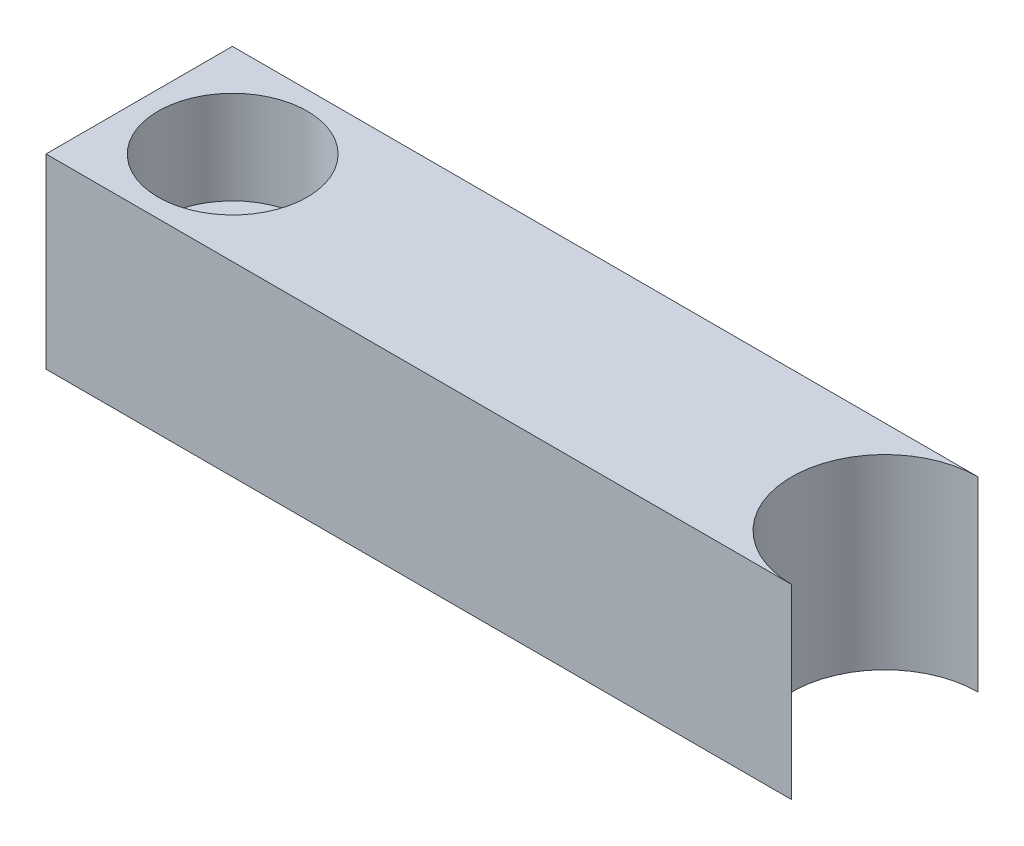
from build123d import *

# Parameters (mm, degrees)
BOSS_EXTRUDE2_DEPTH = 3.175
SKETCH1_6_W         = 3.175
SKETCH1_6_H         = 3.175
SKETCH1_6_R         = 1.27
BOSS_EXTRUDE6_DEPTH = 3.175
SKETCH1_8_R         = 1.27
BOSS_EXTRUDE7_DEPTH = 1.5875


with BuildPart() as part:
    # Sketch1 → Boss-Extrude2 (new body)
    with BuildSketch(Plane(origin=(0, 0, 0), x_dir=(1, 0, 0), z_dir=(0, 1, 0))):
        with BuildLine():
            Line((-2.749630657, 1.5875), (-9.525, 1.5875))
            Line((-9.525, 1.5875), (-9.525, -1.5875))
            Line((-9.525, -1.5875), (-2.749630657, -1.5875))
            Line((-2.749630657, -1.5875), (0, -1.5875))
            ThreePointArc((0, -1.5875), (-1.5875, 0), (0, 1.5875))
            Line((0, 1.5875), (-2.749630657, 1.5875))
        make_face()
    extrude(amount=BOSS_EXTRUDE2_DEPTH)

    # Sketch1<6> → Boss-Extrude6 (add)
    with BuildSketch(Plane(origin=(0, 0, 0), x_dir=(1, 0, 0), z_dir=(0, 1, 0))):
        with Locations((-11.1125, 0)):
            Rectangle(SKETCH1_6_W, SKETCH1_6_H)
        with Locations(Location((-11.107619253, 0, 0), (0, 0, 270))):
            Circle(SKETCH1_6_R, mode=Mode.SUBTRACT)
    extrude(amount=BOSS_EXTRUDE6_DEPTH)

    # Sketch1<8> → Boss-Extrude7 (add)
    with BuildSketch(Plane(origin=(0, 0, 0), x_dir=(1, 0, 0), z_dir=(0, 1, 0))):
        with Locations(Location((-11.107619253, 0, 0), (0, 0, 270))):
            Circle(SKETCH1_8_R)
    extrude(amount=BOSS_EXTRUDE7_DEPTH)


solid = part.part
